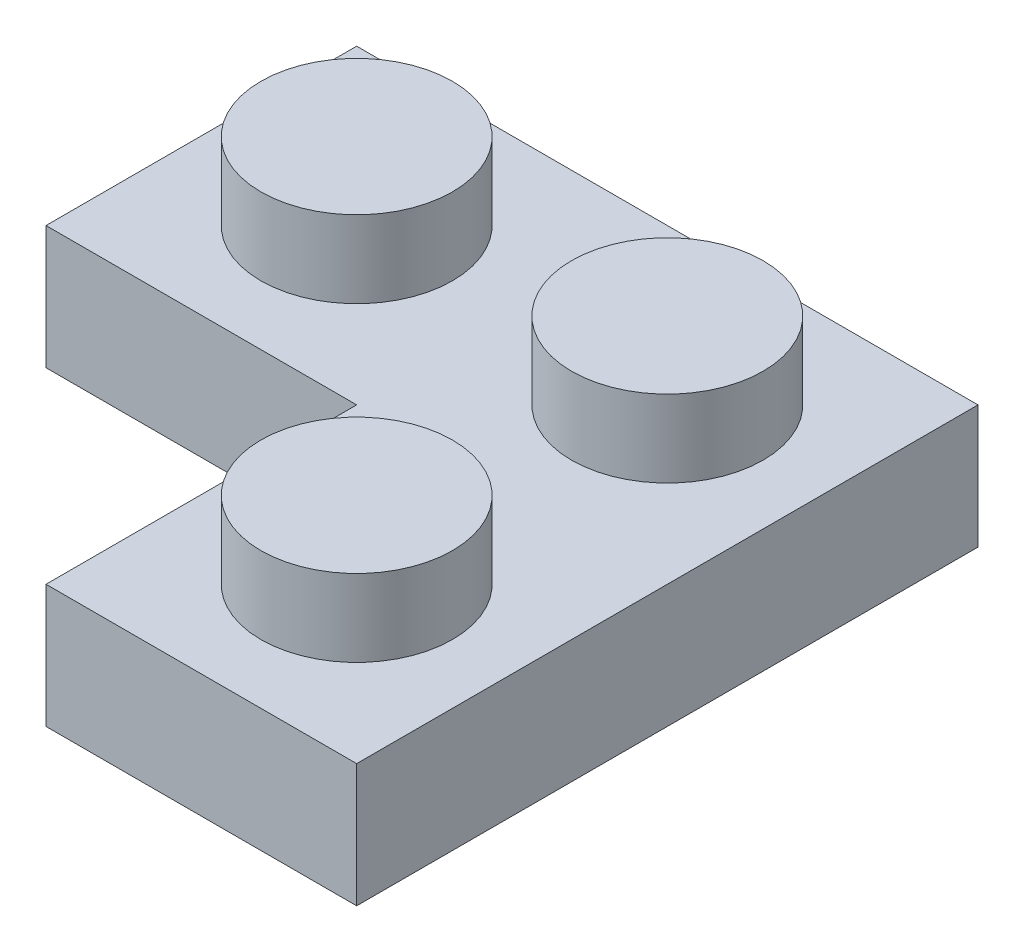
from build123d import *

# Parameters (mm, degrees)
BOSS_EXTRUDE1_DEPTH = 3.15
SKETCH2_R           = 2.45
BOSS_EXTRUDE2_DEPTH = 1.97
SHELL1_T            = -1.55
SKETCH3_R           = 1.48
SKETCH3_R_2         = 0.54
BOSS_EXTRUDE3_DEPTH = 1.4


with BuildPart() as part:
    # Sketch1 → Boss-Extrude1 (new body)
    with BuildSketch(Plane(origin=(0, 0, 0), x_dir=(1, 0, 0), z_dir=(0, 1, 0))):
        Polygon((0, 0), (0, -7.945), (7.945, -7.945), (7.945, 7.945), (-7.945, 7.945), (-7.945, 0), align=None)
    extrude(amount=-BOSS_EXTRUDE1_DEPTH)

    # Sketch2 → Boss-Extrude2 (add)
    with BuildSketch(Plane(origin=(0, 0, 0), x_dir=(1, 0, 0), z_dir=(0, 1, 0))):
        with Locations(Location((3.9725, 3.9725, 0), (0, 0, 90))):
            Circle(SKETCH2_R)
        with Locations(Location((3.9725, -3.9725, 0), (0, 0, 90))):
            Circle(SKETCH2_R)
        with Locations(Location((-3.9725, 3.9725, 0), (0, 0, 90))):
            Circle(SKETCH2_R)
    extrude(amount=BOSS_EXTRUDE2_DEPTH)

    # Shell1
    shell1_openings = [part.faces().sort_by_distance(p)[0] for p in [
        (1.324166667, -3.15, -1.324166667),
    ]]
    offset(amount=SHELL1_T, openings=shell1_openings, kind=Kind.INTERSECTION)

    # Sketch3 → Boss-Extrude3 (add)
    # profile 1 of 2: a face of its own
    with BuildSketch(Plane.XZ.offset(1.55)):
        with Locations(Location((0, -3.975, 0), (0, 0, 270))):
            Circle(SKETCH3_R)
        with Locations(Location((0, -3.975, 0), (0, 0, 270))):
            Circle(SKETCH3_R_2, mode=Mode.SUBTRACT)
    # profile 2 of 2: a face of its own
    with BuildSketch(Plane.XZ.offset(1.55)):
        with Locations(Location((3.97, 0, 0), (0, 0, 270))):
            Circle(SKETCH3_R)
        with Locations(Location((3.97, 0, 0), (0, 0, 270))):
            Circle(SKETCH3_R_2, mode=Mode.SUBTRACT)
    extrude(amount=BOSS_EXTRUDE3_DEPTH)


solid = part.part
